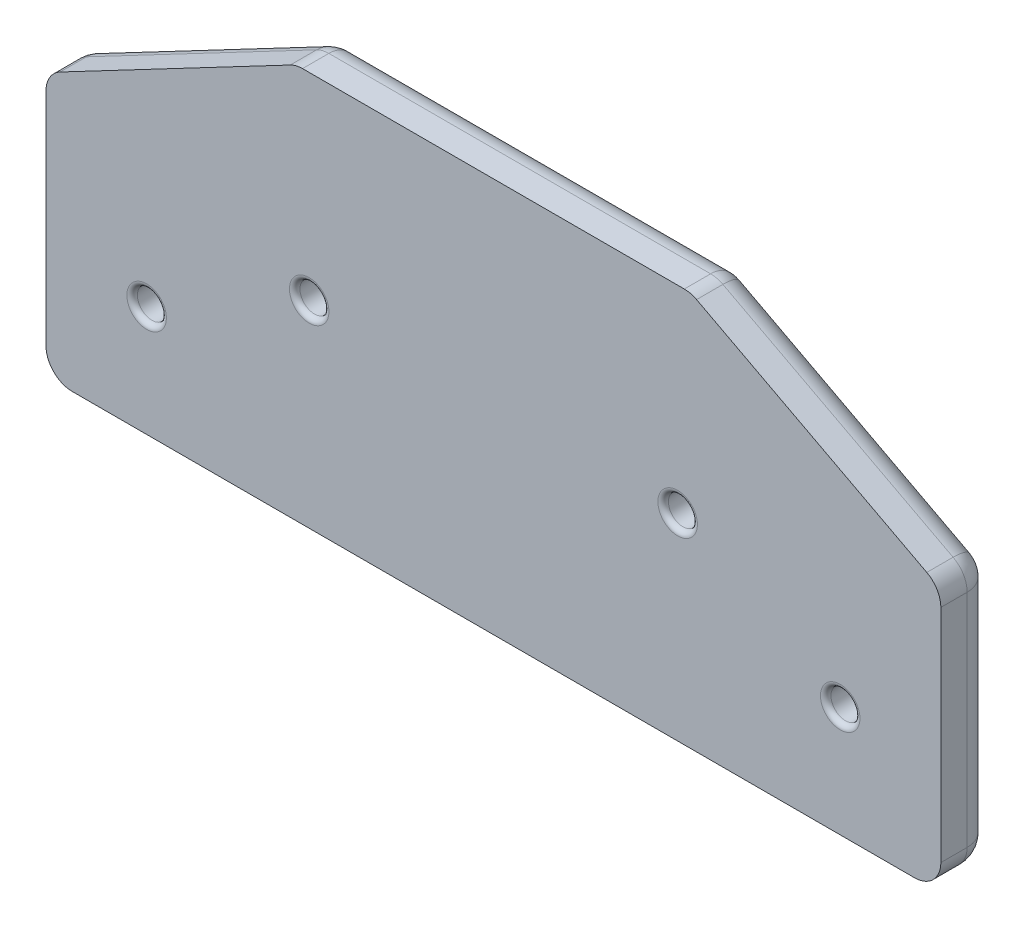
from build123d import *

# Parameters (mm, degrees)
SKETCH2_R           = 2.75
SKETCH2_W           = 75
SKETCH2_H           = 25
BOSS_EXTRUDE1_DEPTH = 10
FILLET1_R           = 5
FILLET2_R           = 5
FILLET3_R           = 1


with BuildPart() as part:
    # Sketch2 → Boss-Extrude1 (new body)
    # profile 1 of 5: a face of its own
    with BuildSketch(Plane.XY):
        Polygon((0, 50), (0, 10), (170, 10), (170, 50), (122.5, 50), (47.5, 50), align=None)
        with Locations((19.117647059, 21.029411765)):
            Circle(SKETCH2_R, mode=Mode.SUBTRACT)
        with Locations((50, 37.5)):
            Circle(SKETCH2_R, mode=Mode.SUBTRACT)
        with Locations((150.882352941, 21.029411765)):
            Circle(SKETCH2_R, mode=Mode.SUBTRACT)
        with Locations((120, 37.5)):
            Circle(SKETCH2_R, mode=Mode.SUBTRACT)
    # profile 2 of 5: a face of its own
    with BuildSketch(Plane.XY):
        Polygon((47.5, 75), (0, 50), (47.5, 50), align=None)
    # profile 3 of 5: a face of its own
    with BuildSketch(Plane.XY):
        with Locations((85, 62.5)):
            Rectangle(SKETCH2_W, SKETCH2_H)
    # profile 4 of 5: a face of its own
    with BuildSketch(Plane.XY):
        Polygon((122.5, 50), (170, 50), (122.5, 75), align=None)
    # profile 5 of 5: a face of its own
    with BuildSketch(Plane.XY):
        Polygon((0, 10), (0, 0), (47.5, 0), (57.5, 0), (112.5, 0), (122.5, 0), (170, 0), (170, 10), align=None)
    extrude(amount=BOSS_EXTRUDE1_DEPTH)

    # Fillet1
    fillet1_edges = [part.edges().sort_by_distance(p)[0] for p in [
        (170, 0, 5),
        (0, 0, 5),
        (0, 50, 5),
        (47.5, 75, 5),
        (122.5, 75, 5),
        (170, 50, 5),
    ]]
    fillet(fillet1_edges, radius=FILLET1_R)

    # Fillet2
    fillet2_edges = [part.edges().sort_by_distance(p)[0] for p in [
        (170, 25.990669664, 0),
        (85, 0, 0),
        (0, 25.990669664, 0),
        (24.538995474, 62.915260776, 0),
        (85, 75, 0),
        (145.461004526, 62.915260776, 0),
        (0.71959927, 49.565554797, 0),
        (47.536071176, 74.854016665, 0),
        (122.463928824, 74.854016665, 0),
        (169.28040073, 49.565554797, 0),
        (1.464466094, 1.464466094, 0),
        (168.535533906, 1.464466094, 0),
    ]]
    fillet(fillet2_edges, radius=FILLET2_R)

    # Fillet3
    fillet3_edges = [part.edges().sort_by_distance(p)[0] for p in [
        (148.132352941, 21.029411765, 10),
        (47.25, 37.5, 0),
        (117.25, 37.5, 0),
        (148.132352941, 21.029411765, 0),
        (16.367647059, 21.029411765, 0),
        (117.25, 37.5, 10),
        (47.25, 37.5, 10),
        (16.367647059, 21.029411765, 10),
    ]]
    fillet(fillet3_edges, radius=FILLET3_R)


solid = part.part
